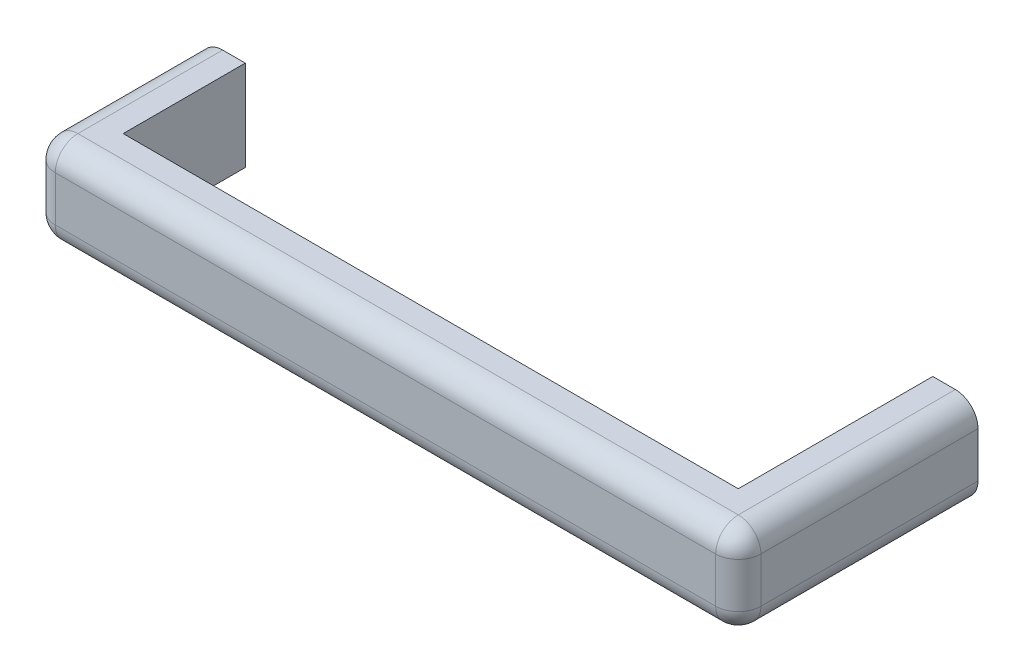
from build123d import *

# Parameters (mm, degrees)
BOSS_EXTRUDE1_DEPTH = 127
FILLET1_R           = 31.75


with BuildPart() as part:
    # Sketch1 → Boss-Extrude1 (new body)
    with BuildSketch(Plane(origin=(0, 0, 0), x_dir=(1, 0, 0), z_dir=(0, 1, 0))):
        Polygon((63.5, 63.5), (927.1, 63.5), (927.1, 336.55), (990.6, 336.55), (990.6, 63.5), (990.6, 0), (0, 0), (0, 63.5), (0, 234.95), (63.5, 234.95), align=None)
    extrude(amount=BOSS_EXTRUDE1_DEPTH)

    # Fillet1
    fillet1_edges = [part.edges().sort_by_distance(p)[0] for p in [
        (495.3, 127, 0),
        (990.6, 0, -168.275),
        (495.3, 0, 0),
        (0, 0, -117.475),
        (990.6, 127, -168.275),
        (990.6, 63.5, 0),
        (0, 63.5, 0),
        (0, 127, -117.475),
    ]]
    fillet(fillet1_edges, radius=FILLET1_R)


solid = part.part
